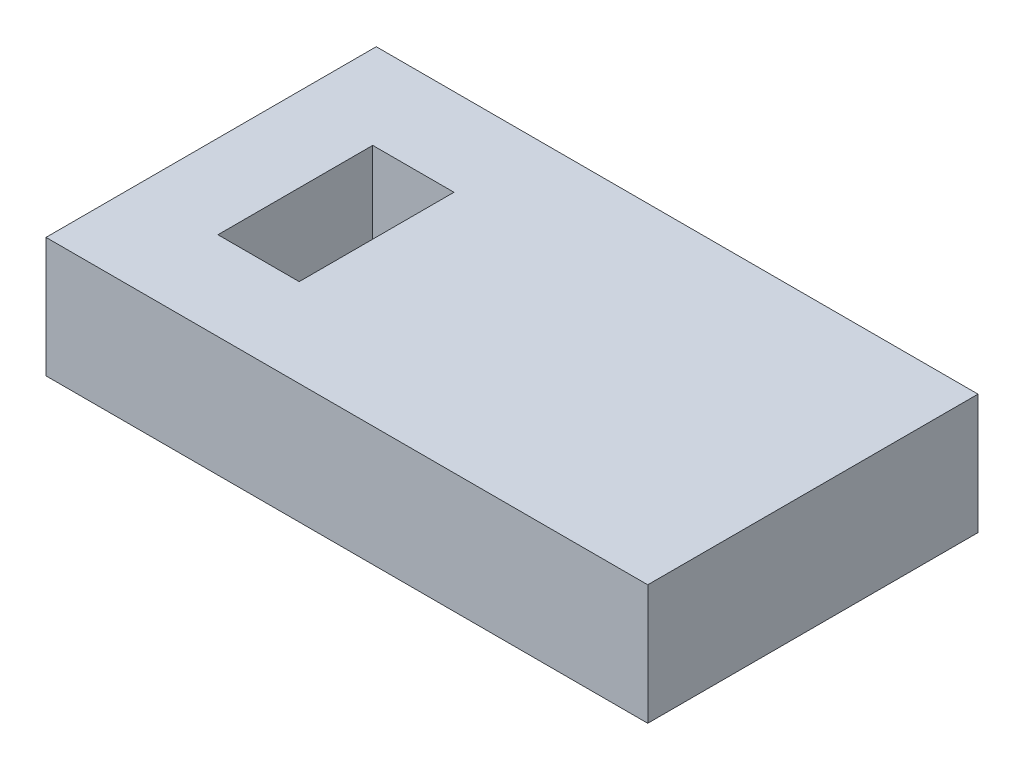
from build123d import *

# Parameters (mm, degrees)
SKETCH1_W           = 155.508745604
SKETCH1_H           = 85.343412613
SKETCH1_W_2         = 21
SKETCH1_H_2         = 40
BOSS_EXTRUDE1_DEPTH = 30
SKETCH2_W           = 155.508745604
SKETCH2_H           = 85.343412613
BOSS_EXTRUDE2_DEPTH = 1


with BuildPart() as part:
    # Sketch1 → Boss-Extrude1 (new body)
    with BuildSketch(Plane(origin=(0, 0, 0), x_dir=(1, 0, 0), z_dir=(0, 1, 0))):
        with Locations((77.754372802, 42.671706307)):
            Rectangle(SKETCH1_W, SKETCH1_H)
        with Locations((32.126366923, 42.80849117)):
            Rectangle(SKETCH1_W_2, SKETCH1_H_2, mode=Mode.SUBTRACT)
    extrude(amount=BOSS_EXTRUDE1_DEPTH)

    # Sketch2 → Boss-Extrude2 (add)
    with BuildSketch(Plane.XZ):
        with Locations((77.754372802, -42.671706307)):
            Rectangle(SKETCH2_W, SKETCH2_H)
    extrude(amount=BOSS_EXTRUDE2_DEPTH)


solid = part.part
